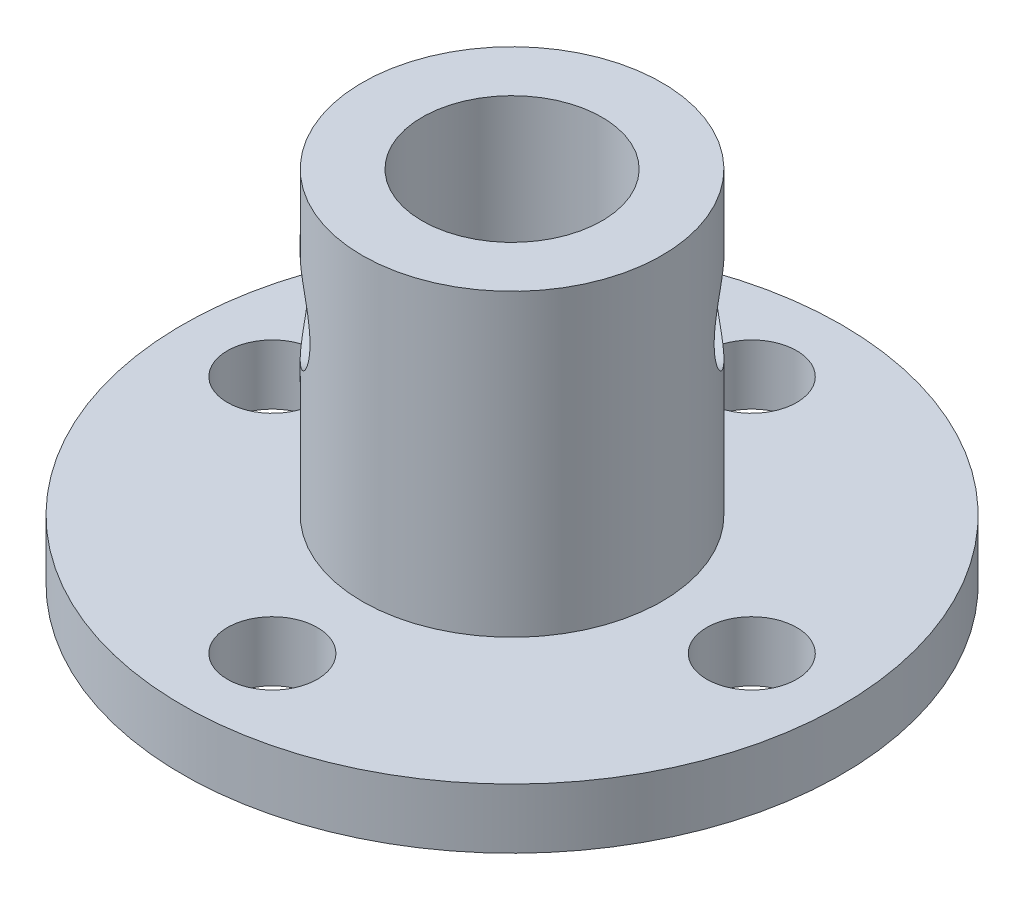
from build123d import *

# Parameters (mm, degrees)
SKETCH_1_R               = 11
SKETCH_1_R_2             = 3
EXTRUDE_1_DEPTH          = 2
SKETCH_2_R               = 5
SKETCH_2_R_2             = 3
EXTRUDE_2_DEPTH          = 10
MM_PRESS_1_D             = 3
CUT_EXTRUDE_1_DEPTH      = 20.646882704
CUT_EXTRUDE_1_DEPTH_BACK = 20.646882704


with BuildPart() as part:
    # 草图1 → 凸台-拉伸1 (new body)
    with BuildSketch(Plane(origin=(0, 0, 0), x_dir=(1, 0, 0), z_dir=(0, 1, 0))):
        with Locations(Location((0, 0, 0), (0, 0, 270))):
            Circle(SKETCH_1_R)
        with Locations(Location((0, 0, 0), (0, 0, 270))):
            Circle(SKETCH_1_R_2, mode=Mode.SUBTRACT)
    extrude(amount=EXTRUDE_1_DEPTH)

    # 草图2 → 凸台-拉伸2 (add)
    with BuildSketch(Plane(origin=(0, 2, 0), x_dir=(1, 0, 0), z_dir=(0, 1, 0))):
        with Locations(Location((0, 0, 0), (0, 0, 270))):
            Circle(SKETCH_2_R)
        with Locations(Location((0, 0, 0), (0, 0, 270))):
            Circle(SKETCH_2_R_2, mode=Mode.SUBTRACT)
    extrude(amount=EXTRUDE_2_DEPTH)

    # 大小mm Press 暗销孔1 (through all)
    with Locations(Plane(origin=(0, 2, 0), x_dir=(1, 0, 0), z_dir=(0, 1, 0))):
        with Locations((-8, 0), (0, 8), (8, 0), (0, -8)):
            Hole(MM_PRESS_1_D / 2)

    # 草图6 → 切除-拉伸1 (cut, two sides: drawn at the far end of the back side and taken through both)
    with BuildSketch(Plane(origin=(0, 0, 0), x_dir=(-0.7071067811865488, 0, -0.7071067811865464), z_dir=(0.7071067811865464, 0, -0.7071067811865488)).offset(-CUT_EXTRUDE_1_DEPTH_BACK)):
        with BuildLine():
            ThreePointArc((-1.5, 8), (0, 6.5), (1.5, 8))
            Line((1.5, 8), (-1.5, 8))
        make_face()
        with BuildLine():
            Line((-1.5, 8), (1.5, 8))
            ThreePointArc((1.5, 8), (0, 9.5), (-1.5, 8))
        make_face()
    extrude(amount=CUT_EXTRUDE_1_DEPTH + CUT_EXTRUDE_1_DEPTH_BACK, mode=Mode.SUBTRACT)


solid = part.part
